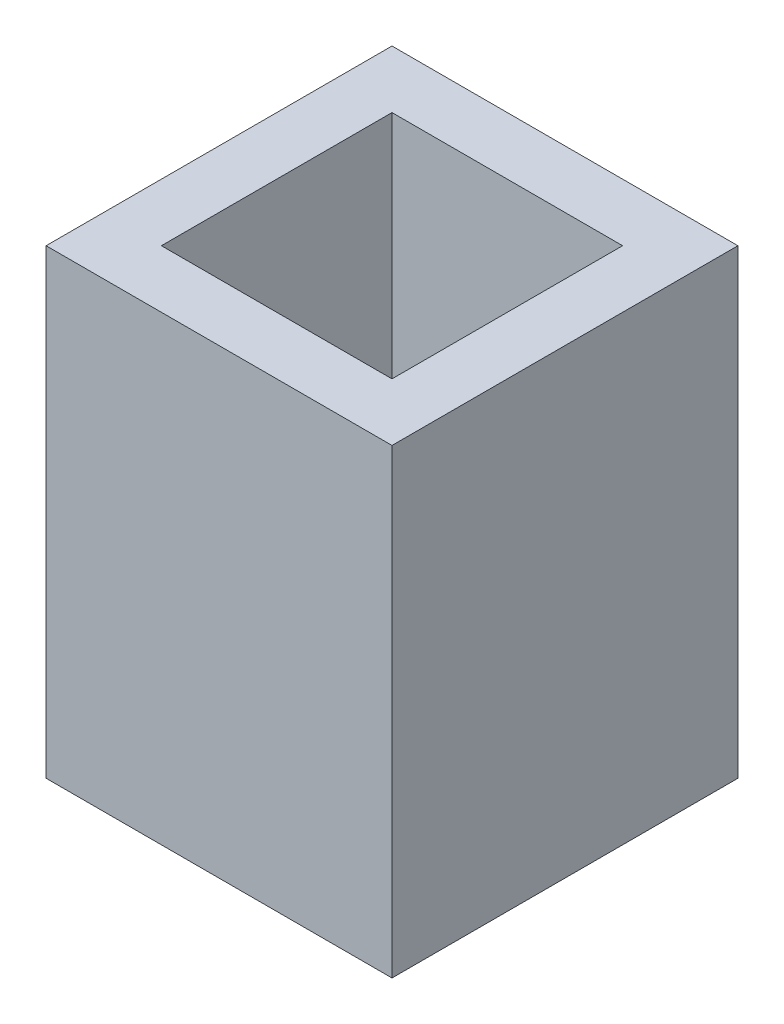
from build123d import *

# Parameters (mm, degrees)
SKETCH1_W           = 19.05
SKETCH1_H           = 19.05
BOSS_EXTRUDE1_DEPTH = 25.4
SKETCH2_W           = 12.7
SKETCH2_H           = 12.7
CUT_EXTRUDE1_DEPTH  = 406.4


with BuildPart() as part:
    # Sketch1 → Boss-Extrude1 (new body)
    with BuildSketch(Plane(origin=(0, 0, 0), x_dir=(1, 0, 0), z_dir=(0, 1, 0))):
        with Locations((9.525, 9.525)):
            Rectangle(SKETCH1_W, SKETCH1_H)
    extrude(amount=BOSS_EXTRUDE1_DEPTH)

    # Sketch2 → Cut-Extrude1 (cut)
    with BuildSketch(Plane(origin=(0, 25.4, 0), x_dir=(1, 0, 0), z_dir=(0, 1, 0))):
        with Locations((9.525, 9.525)):
            Rectangle(SKETCH2_W, SKETCH2_H)
    extrude(amount=-CUT_EXTRUDE1_DEPTH, mode=Mode.SUBTRACT)


solid = part.part
